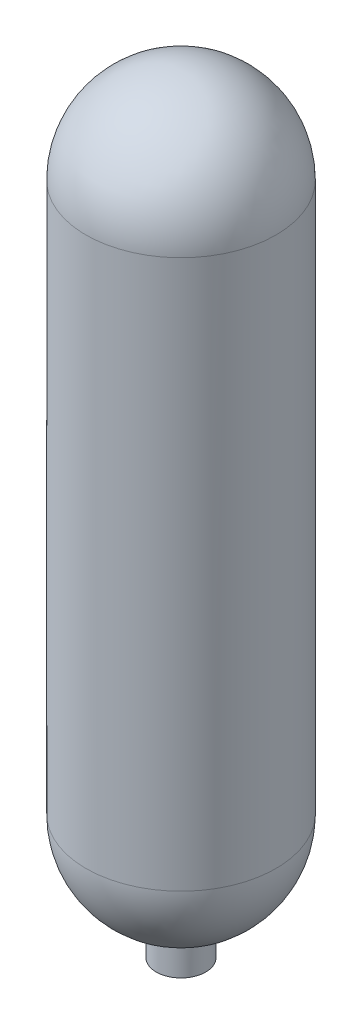
from build123d import *

# Parameters (mm, degrees)
M18X1_5_TAPPED_HOLE1_D     = 16.5
M18X1_5_TAPPED_HOLE1_DEPTH = 15.042899893
M18X1_5_TAPPED_HOLE1_TIP   = 4.957100107
FILLET1_R                  = 5


with BuildPart() as part:
    # Sketch1 → Revolve1 (revolve)
    with BuildSketch(Plane.XY, mode=Mode.PRIVATE) as revolve1_sk:
        with BuildLine():
            Line((0, 0), (15, 0))
            Line((15, 0), (15, 20))
            ThreePointArc((15, 20), (45.654955919, 40.553679643), (57.5, 75.509008278))
            Line((57.5, 75.509008278), (57.5, 407.5))
            ThreePointArc((57.5, 407.5), (40.658639918, 448.158639918), (0, 465))
            Line((0, 465), (0, 0))
        make_face()
    revolve(revolve1_sk.sketch.rotate(Axis((0, 0, 0), (0, 1, 0)), 90), axis=Axis((0, 0, 0), (0, 1, 0)))

    # M18x1.5 Tapped Hole1
    with Locations(Plane(origin=(0, 0, 0), x_dir=(-1, 0, 0), z_dir=(0, -1, 0))):
        with Locations((0, 0)):
            Hole(M18X1_5_TAPPED_HOLE1_D / 2, depth=M18X1_5_TAPPED_HOLE1_DEPTH)
            with Locations((0, 0, -(M18X1_5_TAPPED_HOLE1_DEPTH + M18X1_5_TAPPED_HOLE1_TIP / 2))):  # 118° drill point
                Cone(0, M18X1_5_TAPPED_HOLE1_D / 2, M18X1_5_TAPPED_HOLE1_TIP, mode=Mode.SUBTRACT)

    # Fillet1
    fillet1_edges = [part.edges().sort_by_distance(p)[0] for p in [
        (0, 20, 15),
    ]]
    fillet(fillet1_edges, radius=FILLET1_R)

    # Sketch4 → Cut-Revolve1 (revolve, cut)
    with BuildSketch(Plane.XY):
        with BuildLine():
            Line((8.25, 15.042899893), (8.25, 25.769587292))
            Line((8.25, 25.769587292), (16.8, 25.769587292))
            ThreePointArc((16.8, 25.769587292), (42.651201624, 44.89651083), (52.5, 75.509008278))
            Line((52.5, 75.509008278), (52.5, 407.5))
            ThreePointArc((52.5, 407.5), (37.123106012, 444.623106012), (0, 460))
            Line((0, 460), (0, 15.042899893))
            Line((0, 15.042899893), (8.25, 15.042899893))
        make_face()
    revolve(axis=Axis((0, 0, 0), (0, 1, 0)), mode=Mode.SUBTRACT)


solid = part.part
